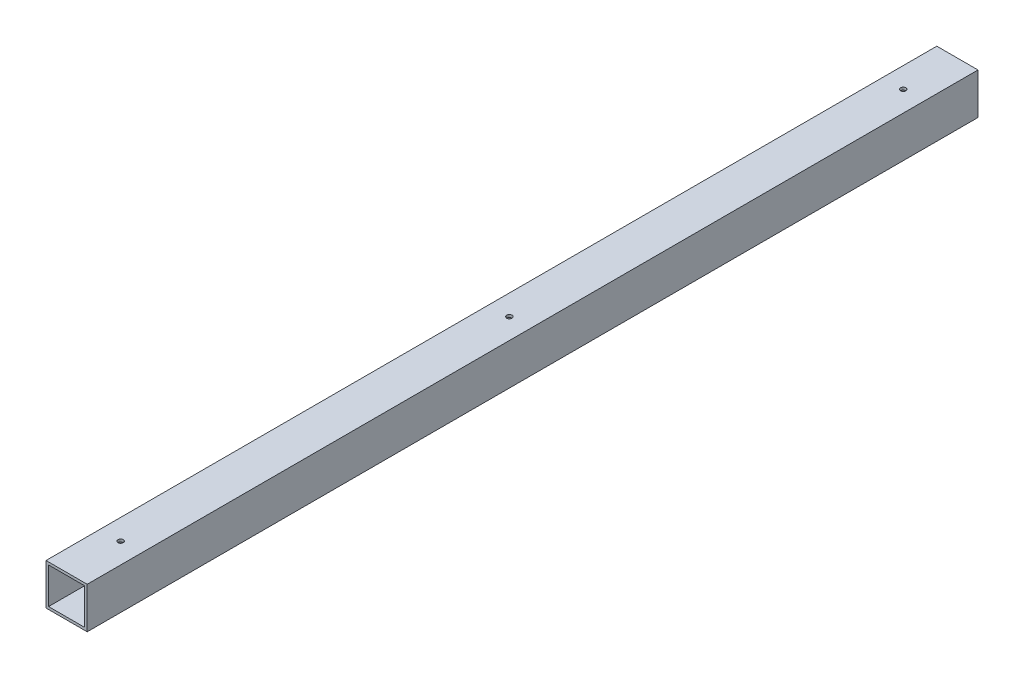
from build123d import *

# Parameters (mm, degrees)
SKETCH1_W           = 50.8
SKETCH1_H           = 50.8
SKETCH1_W_2         = 44.45
SKETCH1_H_2         = 44.45
BOSS_EXTRUDE1_DEPTH = 1098.55
SKETCH2_R           = 3.302
CUT_EXTRUDE1_DEPTH  = 50.8


with BuildPart() as part:
    # Sketch1 → Boss-Extrude1 (new body)
    with BuildSketch(Plane.XY):
        with Locations((2339.531183146, 25.4)):
            Rectangle(SKETCH1_W, SKETCH1_H)
        with Locations((2339.531183146, 25.4)):
            Rectangle(SKETCH1_W_2, SKETCH1_H_2, mode=Mode.SUBTRACT)
    extrude(amount=BOSS_EXTRUDE1_DEPTH)

    # Sketch2 → Cut-Extrude1 (cut)
    with BuildSketch(Plane(origin=(0, 50.8, 0), x_dir=(1, 0, 0), z_dir=(0, 1, 0))):
        with Locations(Location((2339.531183146, -552.45, 0), (0, 0, 270))):
            Circle(SKETCH2_R)
        with Locations(Location((2339.531183146, -1031.875, 0), (0, 0, 270))):
            Circle(SKETCH2_R)
        with Locations(Location((2339.531183146, -66.802, 0), (0, 0, 90))):
            Circle(SKETCH2_R)
    extrude(amount=-CUT_EXTRUDE1_DEPTH, mode=Mode.SUBTRACT)


solid = part.part
